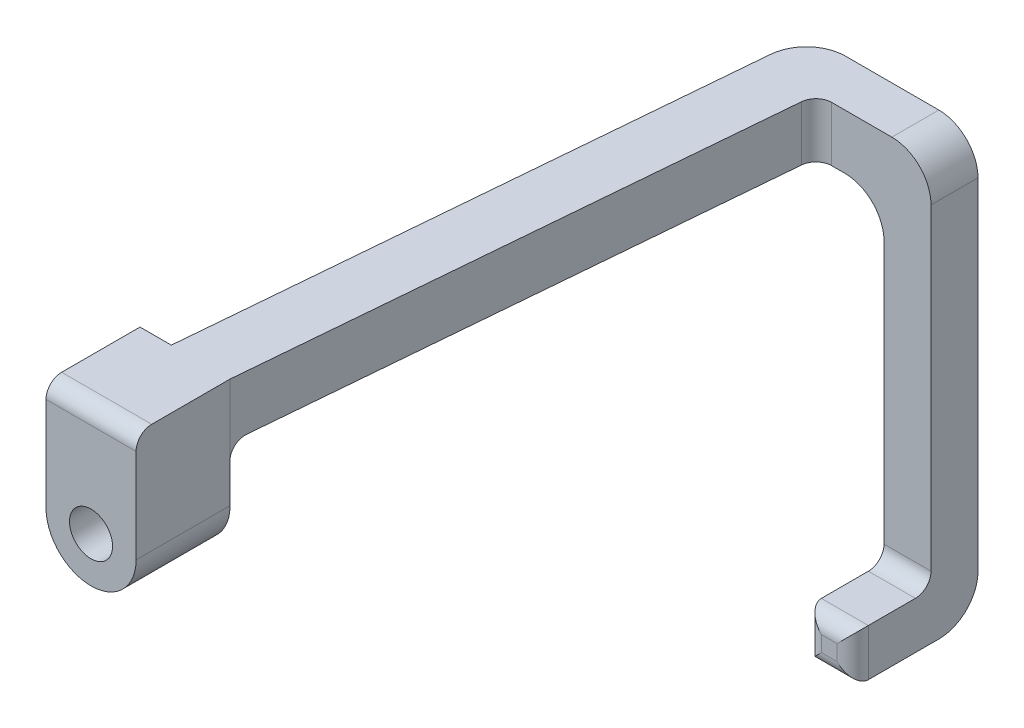
from build123d import *

# Parameters (mm, degrees)
SKETCH1_R           = 1.375
BOSS_EXTRUDE1_DEPTH = 6
BOSS_EXTRUDE2_START = 5.865
SKETCH9_W           = 3.5
SKETCH9_H           = 3
BOSS_EXTRUDE2_DEPTH = 7.26
BOSS_EXTRUDE3_START = -26.75
SKETCH10_W          = 3
SKETCH10_H          = 3
BOSS_EXTRUDE3_DEPTH = 23.25
SKETCH11_W          = 3
SKETCH11_H          = 3
BOSS_EXTRUDE4_DEPTH = 5
FILLET1_R           = 2.5
FILLET2_R           = 1


with BuildPart() as part:
    # Sketch1 → Boss-Extrude1 (new body)
    with BuildSketch(Plane(origin=(0, 0, 0), x_dir=(0, 1, 0), z_dir=(0, 0, 1))):
        with BuildLine():
            Line((0, 2.875), (7, 2.875))
            Line((7, 2.875), (7, -2.875))
            Line((7, -2.875), (0, -2.875))
            ThreePointArc((0, -2.875), (-2.875, 0), (0, 2.875))
        make_face()
        with Locations(Location((0, 0, 0), (0, 0, 270))):
            Circle(SKETCH1_R, mode=Mode.SUBTRACT)
    extrude(amount=BOSS_EXTRUDE1_DEPTH)

    # Sketch2 → Loft1 section 0
    with BuildSketch(Plane(origin=(0, 0, 0), x_dir=(1, 0, 0), z_dir=(0, 0, -1))):
        with BuildLine():
            Line((2.875, -7), (-0.875, -7))
            Line((-0.875, -7), (-0.875, -3.5))
            Line((-0.875, -3.5), (2.875, -3.5))
            Line((2.875, -3.5), (2.875, -7))
        make_face()
    # Sketch8 → Loft1 section 1
    with BuildSketch(Plane(origin=(0, 0, -37.5), x_dir=(-1, 0, 0), z_dir=(0, 0, -1))):
        with BuildLine():
            Line((-6.125, 3.5), (-6.125, 7))
            Line((-6.125, 7), (-2.375, 7))
            Line((-2.375, 7), (-2.375, 3.5))
            Line((-2.375, 3.5), (-6.125, 3.5))
        make_face()
    loft()

    # Sketch9 → Boss-Extrude2 (add)
    with BuildSketch(Plane.YZ.offset(BOSS_EXTRUDE2_START)):
        with Locations((5.25, -36)):
            Rectangle(SKETCH9_W, SKETCH9_H)
    extrude(amount=BOSS_EXTRUDE2_DEPTH)

    # Sketch10 → Boss-Extrude3 (add)
    with BuildSketch(Plane(origin=(0, 7, 0), x_dir=(-1, 0, 0), z_dir=(0, 1, 0)).offset(BOSS_EXTRUDE3_START)):
        with Locations((-11.625, -36)):
            Rectangle(SKETCH10_W, SKETCH10_H)
    extrude(amount=BOSS_EXTRUDE3_DEPTH)

    # Sketch11 → Boss-Extrude4 (add)
    with BuildSketch(Plane.XY.offset(-34.5)):
        with Locations((11.625, -18.25)):
            Rectangle(SKETCH11_W, SKETCH11_H)
    extrude(amount=BOSS_EXTRUDE4_DEPTH)

    # Fillet1
    fillet1_edges = [part.edges().sort_by_distance(p)[0] for p in [
        (2.375, 5.25, -37.5),
        (13.125, 7, -36),
        (11.625, -19.75, -37.5),
        (10.125, 3.5, -36),
    ]]
    fillet(fillet1_edges, radius=FILLET1_R)

    # Fillet2
    fillet2_edges = [part.edges().sort_by_distance(p)[0] for p in [
        (0, 7, 6),
        (1, 3.5, 0),
        (5.865, 5.25, -34.5),
        (11.625, -16.75, -34.5),
        (11.625, -19.75, -29.5),
        (13.125, -18.25, -29.5),
        (11.625, -16.75, -29.5),
        (10.125, -18.25, -29.5),
    ]]
    fillet(fillet2_edges, radius=FILLET2_R)


solid = part.part
